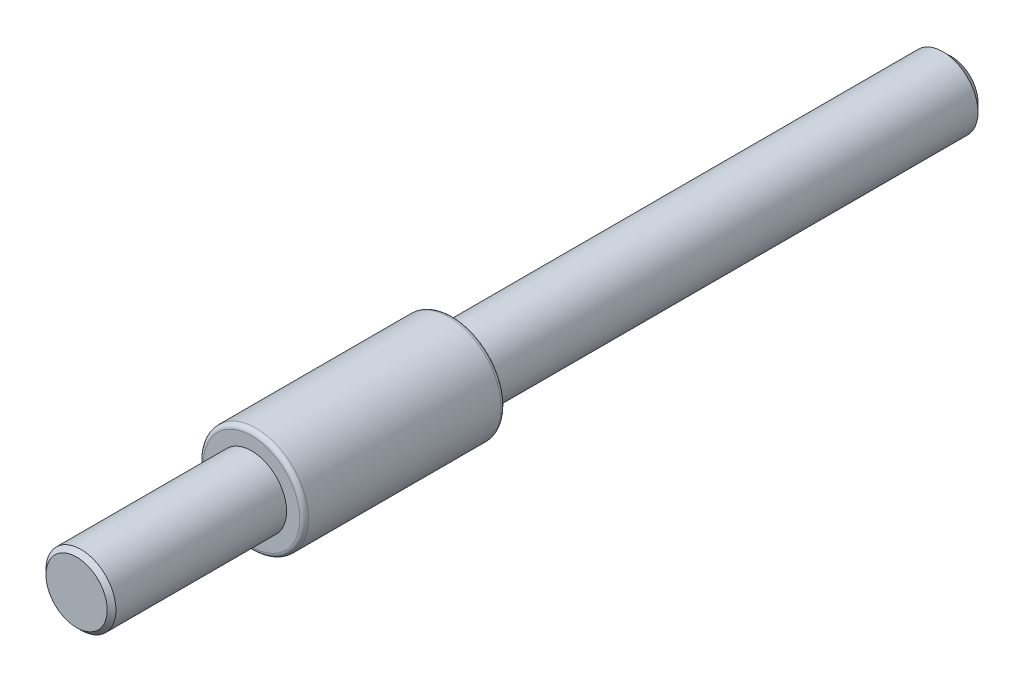
from build123d import *

# Parameters (mm, degrees)
SKETCH_1_R      = 4
EXTRUDE_1_DEPTH = 20
SKETCH_2_R      = 6
EXTRUDE_2_DEPTH = 23
EXTRUDE_START   = 57
SKETCH_3_R      = 4
EXTRUDE_5_DEPTH = 57
CHAMFER_1_SIZE  = 1
CHAMFER_2_SIZE  = 0.5
FILLET_1_R      = 0.5
FILLET_2_R      = 0.5


with BuildPart() as part:
    # 草图1 → 凸台-拉伸1 (new body)
    with BuildSketch(Plane.XY):
        Circle(SKETCH_1_R)
    extrude(amount=EXTRUDE_1_DEPTH)

    # 草图2 → 凸台-拉伸2 (add)
    with BuildSketch(Plane.XY):
        Circle(SKETCH_2_R)
    extrude(amount=-EXTRUDE_2_DEPTH)

    # 草图3 → 凸台-拉伸5 (add)
    with BuildSketch(Plane(origin=(0, 0, -23), x_dir=(-1, 0, 0), z_dir=(0, 0, -1)).offset(EXTRUDE_START)):
        with Locations(Location((0, 0, 0), (0, 0, 180))):
            Circle(SKETCH_3_R)
    extrude(amount=-EXTRUDE_5_DEPTH)

    # 倒角1
    chamfer_1_edges = [part.edges().sort_by_distance(p)[0] for p in [
        (-4, 0, -80),
    ]]
    chamfer(chamfer_1_edges, length=CHAMFER_1_SIZE)

    # 倒角2
    chamfer_2_edges = [part.edges().sort_by_distance(p)[0] for p in [
        (-4, 0, 20),
    ]]
    chamfer(chamfer_2_edges, length=CHAMFER_2_SIZE)

    # 圆角1
    fillet_1_edges = [part.edges().sort_by_distance(p)[0] for p in [
        (-6, 0, -23),
    ]]
    fillet(fillet_1_edges, radius=FILLET_1_R)

    # 圆角2
    fillet_2_edges = [part.edges().sort_by_distance(p)[0] for p in [
        (-6, 0, 0),
    ]]
    fillet(fillet_2_edges, radius=FILLET_2_R)


solid = part.part
